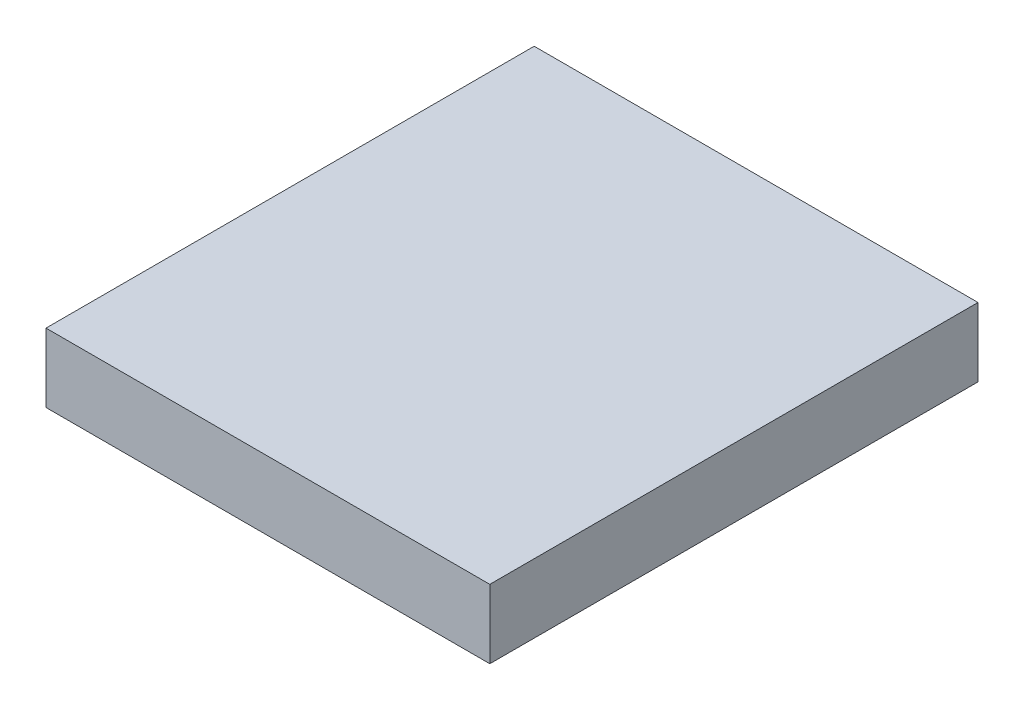
from build123d import *

# Parameters (mm, degrees)
SKETCH1_W                   = 100
SKETCH1_H                   = 110
GEAR_PUMP_RISER_BLANK_DEPTH = 15.5


with BuildPart() as part:
    # Sketch1 → Gear_pump_riser_blank (new body)
    with BuildSketch(Plane(origin=(0, 0, 0), x_dir=(1, 0, 0), z_dir=(0, 1, 0))):
        Rectangle(SKETCH1_W, SKETCH1_H)
    extrude(amount=GEAR_PUMP_RISER_BLANK_DEPTH)


solid = part.part
